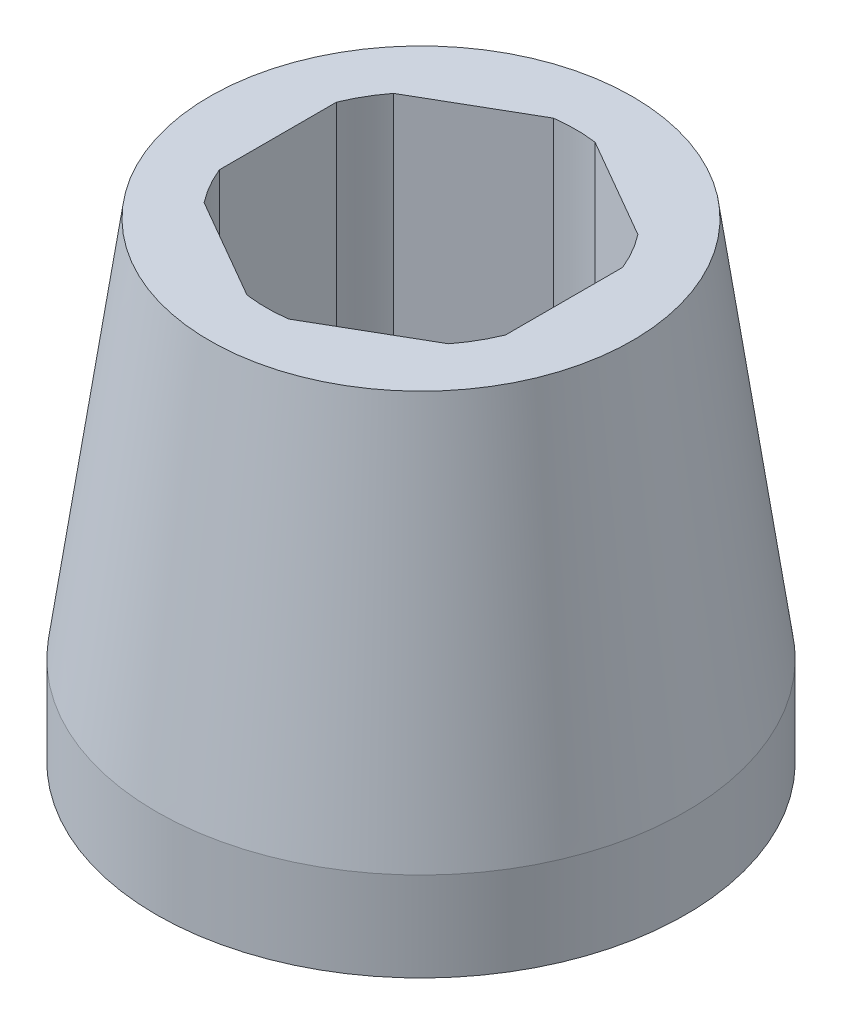
from build123d import *

# Parameters (mm, degrees)
BOSS_EXTRUDE1_START = -10.876
BOSS_EXTRUDE1_DEPTH = 10.876
CHAMFER1_SIZE       = 0.75


with BuildPart() as part:
    # Sketch1 → Revolve1 (revolve)
    with BuildSketch(Plane.XY, mode=Mode.PRIVATE) as revolve1_sk:
        Polygon((6.8, 0), (6.8, 4.953), (5.2, 4.953), (5.2, 15.829), (7.112, 15.829), (8.9, 3), (8.9, 0), align=None)
    revolve(revolve1_sk.sketch.rotate(Axis((0, 0, 0), (0, 1, 0)), 90), axis=Axis((0, 0, 0), (0, 1, 0)))

    # Sketch4 → Boss-Extrude1 (add)
    with BuildSketch(Plane.XZ.offset(-4.953).offset(BOSS_EXTRUDE1_START)):
        with BuildLine():
            Line((0.700412138, 5.152613205), (4.112087862, 3.182881307))
            ThreePointArc((4.112087862, 3.182881307), (2.6, 4.5033321), (0.700412138, 5.152613205))
        make_face()
        with BuildLine():
            ThreePointArc((4.8125, -1.969731898), (5.2, 0), (4.8125, 1.969731898))
            Line((4.8125, 1.969731898), (4.8125, -1.969731898))
        make_face()
        with BuildLine():
            Line((-4.112087862, 3.182881307), (-0.700412138, 5.152613205))
            ThreePointArc((-0.700412138, 5.152613205), (-2.6, 4.5033321), (-4.112087862, 3.182881307))
        make_face()
        with BuildLine():
            ThreePointArc((0.700412138, -5.152613205), (2.6, -4.5033321), (4.112087862, -3.182881307))
            Line((4.112087862, -3.182881307), (0.700412138, -5.152613205))
        make_face()
        with BuildLine():
            Line((-4.8125, -1.969731898), (-4.8125, 1.969731898))
            ThreePointArc((-4.8125, 1.969731898), (-5.2, 0), (-4.8125, -1.969731898))
        make_face()
        with BuildLine():
            ThreePointArc((-4.112087862, -3.182881307), (-2.6, -4.5033321), (-0.700412138, -5.152613205))
            Line((-0.700412138, -5.152613205), (-4.112087862, -3.182881307))
        make_face()
    extrude(amount=BOSS_EXTRUDE1_DEPTH)

    # Chamfer1
    chamfer1_edges = [part.edges().sort_by_distance(p)[0] for p in [
        (0, 0, 6.8),
    ]]
    chamfer(chamfer1_edges, length=CHAMFER1_SIZE)


solid = part.part
